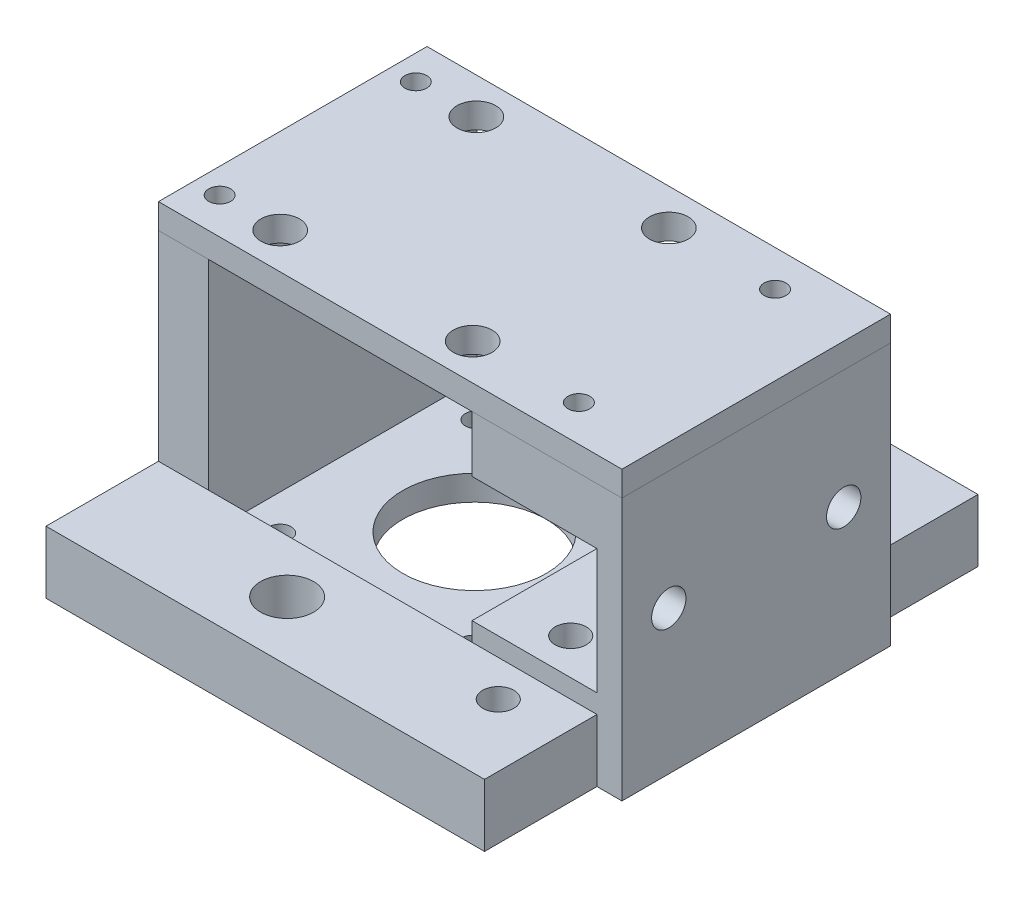
from build123d import *

# Parameters (mm, degrees)
SKETCH1_W           = 74.2
SKETCH1_H           = 46
BOSS_EXTRUDE1_DEPTH = 43
SKETCH2_R           = 11.5
SKETCH2_R_2         = 1.75
SKETCH2_R_3         = 2.5
CUT_EXTRUDE1_DEPTH  = 20
SKETCH3_R           = 3.1
SKETCH3_R_2         = 1.75
CUT_EXTRUDE2_DEPTH  = 15
CUT_EXTRUDE3_DEPTH  = 2.4
SKETCH5_R           = 2.75
CUT_EXTRUDE4_DEPTH  = 12.4
SKETCH7_W           = 70.2
SKETCH7_H           = 18
SKETCH7_R           = 4.25
SKETCH7_R_2         = 2.5
BOSS_EXTRUDE8_DEPTH = 10


with BuildPart() as part:
    # Sketch1 → Boss-Extrude1 (new body)
    with BuildSketch(Plane.XY):
        with Locations((-13.1, 10)):
            Rectangle(SKETCH1_W, SKETCH1_H)
        Polygon((0, 0), (20, 0), (20, 20), (0, 20), (0, 29), (-42.2, 29), (-42.2, -9), (0, -9), align=None, mode=Mode.SUBTRACT)
    extrude(amount=BOSS_EXTRUDE1_DEPTH)

    # Sketch2 → Cut-Extrude1 (cut)
    with BuildSketch(Plane.XZ.offset(13)):
        with Locations((-21.1, 21.5)):
            Circle(SKETCH2_R)
        with Locations((-36.509600894, 37.201726029)):
            Circle(SKETCH2_R_2)
        with Locations((-5.690399106, 5.798273971)):
            Circle(SKETCH2_R_2)
        with Locations((-36.509600894, 5.798273971)):
            Circle(SKETCH2_R_2)
        with Locations((-5.690399106, 37.201726029)):
            Circle(SKETCH2_R_2)
        with Locations((10, 37.201726029)):
            Circle(SKETCH2_R_3)
        with Locations((10, 5.798273971)):
            Circle(SKETCH2_R_3)
    extrude(amount=-CUT_EXTRUDE1_DEPTH, mode=Mode.SUBTRACT)

    # Sketch3 → Cut-Extrude2 (cut)
    with BuildSketch(Plane(origin=(0, 33, 0), x_dir=(1, 0, 0), z_dir=(0, 1, 0))):
        with Locations(Location((-36.509600894, -5.798273971, 0), (0, 0, 270))):
            Circle(SKETCH3_R)
        with Locations(Location((-5.690399106, -5.798273971, 0), (0, 0, 270))):
            Circle(SKETCH3_R)
        with Locations(Location((-5.690399106, -37.201726029, 0), (0, 0, 270))):
            Circle(SKETCH3_R)
        with Locations(Location((-36.509600894, -37.201726029, 0), (0, 0, 270))):
            Circle(SKETCH3_R)
        with Locations(Location((-46.2, -5.798273971, 0), (0, 0, 270))):
            Circle(SKETCH3_R_2)
        with Locations(Location((-46.2, -37.201726029, 0), (0, 0, 270))):
            Circle(SKETCH3_R_2)
        with Locations(Location((11.309600894, -5.798273971, 0), (0, 0, 270))):
            Circle(SKETCH3_R_2)
        with Locations(Location((11.309600894, -37.201726029, 0), (0, 0, 270))):
            Circle(SKETCH3_R_2)
    extrude(amount=-CUT_EXTRUDE2_DEPTH, mode=Mode.SUBTRACT)


with BuildPart() as body_2:
    # Split1: the piece on the far side of the plane
    add(part.part)
    split(bisect_by=Plane.ZX.offset(29), keep=Keep.BOTTOM)

    # Sketch4 → Cut-Extrude3 (cut)
    with BuildSketch(Plane(origin=(0, 29, 0), x_dir=(1, 0, 0), z_dir=(0, 1, 0))):
        Polygon((-46.2, -2.334172356), (-49.2, -4.066223163), (-49.2, -7.530324778), (-46.2, -9.262375586), (-43.2, -7.530324778), (-43.2, -4.066223163), align=None)
        Polygon((-43.2, -35.469675222), (-46.2, -33.737624414), (-49.2, -35.469675222), (-49.2, -38.933776837), (-46.2, -40.665827644), (-43.2, -38.933776837), align=None)
        Polygon((14.309600894, -4.066223163), (11.309600894, -2.334172356), (8.309600894, -4.066223163), (8.309600894, -7.530324778), (11.309600894, -9.262375586), (14.309600894, -7.530324778), align=None)
        Polygon((14.309600894, -35.469675222), (11.309600894, -33.737624414), (8.309600894, -35.469675222), (8.309600894, -38.933776837), (11.309600894, -40.665827644), (14.309600894, -38.933776837), align=None)
    extrude(amount=-CUT_EXTRUDE3_DEPTH, mode=Mode.SUBTRACT)

    # Sketch5 → Cut-Extrude4 (cut)
    with BuildSketch(Plane(origin=(24, 0, 0), x_dir=(0, 0, -1), z_dir=(1, 0, 0))):
        with Locations(Location((-35.5, 10, 0), (0, 0, 90))):
            Circle(SKETCH5_R)
        with Locations(Location((-7.5, 10, 0), (0, 0, 90))):
            Circle(SKETCH5_R)
    extrude(amount=-CUT_EXTRUDE4_DEPTH, mode=Mode.SUBTRACT)

    # Sketch7 → Boss-Extrude8 (add)
    # profile 1 of 2: a face of its own
    with BuildSketch(Plane.XZ.offset(13)):
        with Locations((-15.1, -9)):
            Rectangle(SKETCH7_W, SKETCH7_H)
        with Locations(Location((-21.1, -8.5, 0), (0, 0, 270))):
            Circle(SKETCH7_R, mode=Mode.SUBTRACT)
        with Locations(Location((10, -5.798273971, 0), (0, 0, 270))):
            Circle(SKETCH7_R_2, mode=Mode.SUBTRACT)
    # profile 2 of 2: a face of its own
    with BuildSketch(Plane.XZ.offset(13)):
        with Locations((-15.1, 52)):
            Rectangle(SKETCH7_W, SKETCH7_H)
        with Locations(Location((-21.1, 51.5, 0), (0, 0, 270))):
            Circle(SKETCH7_R, mode=Mode.SUBTRACT)
        with Locations(Location((10, 48.798273971, 0), (0, 0, 270))):
            Circle(SKETCH7_R_2, mode=Mode.SUBTRACT)
    extrude(amount=-BOSS_EXTRUDE8_DEPTH)


with BuildPart() as part_1:
    add(part.part)

    # Split1
    split(bisect_by=Plane.ZX.offset(29), keep=Keep.TOP)


solid = Compound([body_2.part, part_1.part])
